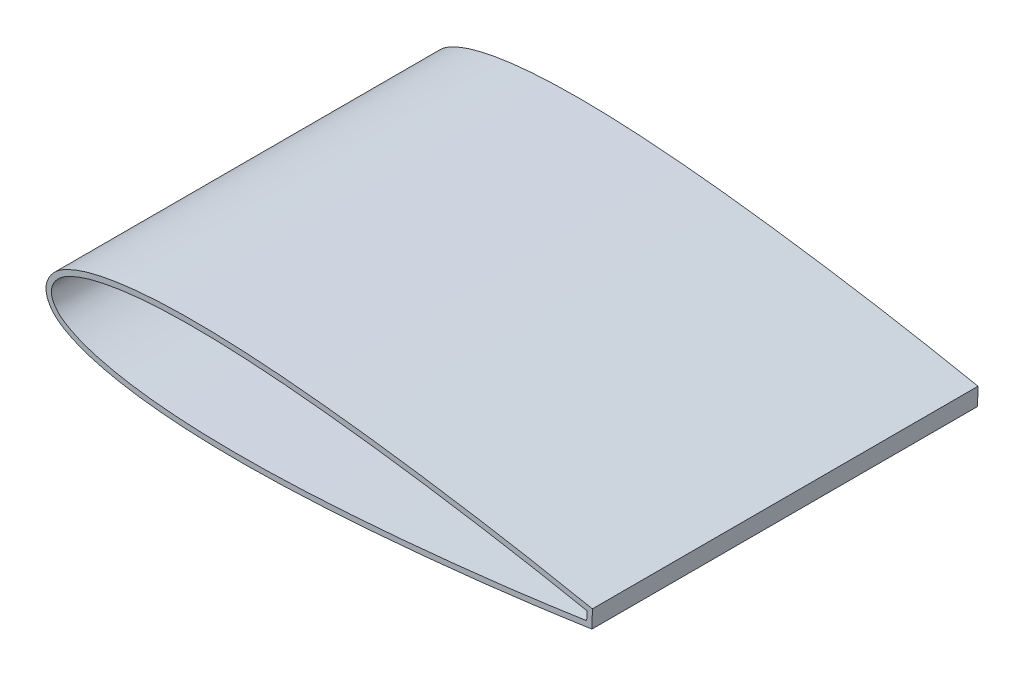
from build123d import *

# Parameters (mm, degrees)
SALIENTE_EXTRUIR1_DEPTH = 70
SALIENTE_EXTRUIR2_DEPTH = 2


with BuildPart() as part:
    # Croquis1 → Saliente-Extruir1 (new body)
    with BuildSketch(Plane.XY):
        with BuildLine():
            Line((100.937242611, -4.288444237), (101.020891316, -0.965925894))
            add(Edge.make_bspline(
                [(101.020891316, -0.965925894), (96.815291407, -0.132900663), (88.398945531, 1.498301529), (75.701280173, 3.619117953), (65.092277681, 5.174420406), (56.575812426, 6.26109804), (50.172982061, 6.981711997), (43.751572486, 7.593424271), (37.308792099, 8.061989495), (30.843527308, 8.352139743), (25.435555721, 8.401904422), (21.096425097, 8.283801601), (17.836833169, 8.098688927), (14.572616656, 7.799403619), (11.300179337, 7.349746902), (8.578434848, 6.808392395), (6.396383224, 6.231750099), (4.745451812, 5.682992115), (3.125080642, 4.988256194), (1.502764958, 4.120049599), (0.070003363, 2.835558423), (-0.776195719, 1.331451533), (-1.099161709, -0.057233354), (-0.846484471, -1.460410805), (-0.077045136, -3.005193487), (1.289264818, -4.360154916), (2.865836447, -5.308897645), (4.449195193, -6.08429162), (6.070421174, -6.715430408), (8.220691339, -7.40114452), (10.911746345, -8.078773269), (14.15741081, -8.692531647), (17.402431679, -9.155695443), (20.648579068, -9.504598536), (24.97626948, -9.840899809), (30.379893961, -10.063331075), (36.851568545, -10.098885043), (43.309765174, -9.955118637), (49.753821325, -9.667311138), (56.184801812, -9.269805003), (64.745160028, -8.613058533), (75.418985998, -7.593578871), (88.207285786, -6.114404653), (96.695052319, -4.908785399), (100.937242611, -4.288444237)],
                knots=[-0.007442072, -0.007442072, -0.007442072, -0.007442072, 0.055988187, 0.119418446, 0.182848705, 0.214563835, 0.246278964, 0.277994094, 0.309709223, 0.341424353, 0.373139482, 0.388997047, 0.404854612, 0.420712176, 0.436569741, 0.452427306, 0.460356088, 0.468284871, 0.476213653, 0.484142435, 0.492071218, 0.496035609, 0.5, 0.503964391, 0.507928782, 0.515857565, 0.523786347, 0.531715129, 0.539643912, 0.547572694, 0.563430259, 0.579287824, 0.595145388, 0.611002953, 0.626860518, 0.658575647, 0.690290777, 0.722005906, 0.753721036, 0.785436165, 0.817151295, 0.880581554, 0.944011813, 1.007442072, 1.007442072, 1.007442072, 1.007442072], degree=3))
        make_face()
        with BuildLine():
            Line((99.958767472, -3.420892718), (100, -1.783140771))
            add(Edge.make_bspline(
                [(100, -1.783140771), (95.834430226, -0.958044519), (87.493341503, 0.643007476), (74.92283071, 2.727733467), (62.313738875, 4.564075903), (49.656886325, 6.084765045), (39.060280254, 6.989417585), (30.550694733, 7.359111002), (24.154602236, 7.407912917), (18.817306664, 7.18883232), (14.552103281, 6.789952354), (11.358212052, 6.344535771), (8.185565208, 5.706610836), (5.563950621, 4.948823424), (3.511123189, 4.06369616), (2.041867828, 3.263736438), (0.599002867, 1.952554653), (-0.278987019, -0.077882315), (0.495717549, -2.149928008), (1.870774979, -3.532054641), (3.297914427, -4.404934857), (5.303600935, -5.392240469), (7.883761837, -6.280989321), (11.020288463, -7.077755876), (14.187719714, -7.683326997), (18.427447641, -8.296329633), (23.746957166, -8.78370911), (30.137402271, -9.056824852), (38.654810324, -9.115808067), (49.28351442, -8.745530221), (62.000854282, -7.86366926), (74.686377832, -6.664151551), (87.34586805, -5.214623536), (95.756955594, -4.035329291), (99.958767472, -3.420892718)],
                knots=[-0.003280902, -0.003280902, -0.003280902, -0.003280902, 0.059629211, 0.122539324, 0.185449436, 0.248359549, 0.311269662, 0.342724718, 0.374179775, 0.405634831, 0.421362359, 0.437089887, 0.452817415, 0.468544944, 0.476408708, 0.484272472, 0.492136236, 0.5, 0.507863764, 0.515727528, 0.523591292, 0.531455056, 0.547182585, 0.562910113, 0.578637641, 0.594365169, 0.625820225, 0.657275282, 0.688730338, 0.751640451, 0.814550564, 0.877460676, 0.940370789, 1.003280902, 1.003280902, 1.003280902, 1.003280902], degree=3))
        make_face(mode=Mode.SUBTRACT)
    extrude(amount=SALIENTE_EXTRUIR1_DEPTH)

    # Croquis4 → Saliente-Extruir2 (add)
    with BuildSketch(Plane(origin=(0, 0, 0), x_dir=(-1, 0, 0), z_dir=(0, 0, -1))):
        with BuildLine():
            Line((-100.937242611, -4.288444237), (-101.020891316, -0.965925894))
            add(Edge.make_bspline(
                [(-101.020891316, -0.965925894), (-96.815291407, -0.132900663), (-88.398945531, 1.498301529), (-75.701280173, 3.619117953), (-65.092277681, 5.174420406), (-56.575812426, 6.26109804), (-50.172982061, 6.981711997), (-43.751572486, 7.593424271), (-37.308792099, 8.061989495), (-30.843527308, 8.352139743), (-25.435555721, 8.401904422), (-21.096425097, 8.283801601), (-17.836833169, 8.098688927), (-14.572616656, 7.799403619), (-11.300179337, 7.349746902), (-8.578434848, 6.808392395), (-6.396383224, 6.231750099), (-4.745451812, 5.682992115), (-3.125080642, 4.988256194), (-1.502764958, 4.120049599), (-0.070003363, 2.835558423), (0.776195719, 1.331451533), (1.099161709, -0.057233354), (0.846484471, -1.460410805), (0.077045136, -3.005193487), (-1.289264818, -4.360154916), (-2.865836447, -5.308897645), (-4.449195193, -6.08429162), (-6.070421174, -6.715430408), (-8.220691339, -7.40114452), (-10.911746345, -8.078773269), (-14.15741081, -8.692531647), (-17.402431679, -9.155695443), (-20.648579068, -9.504598536), (-24.97626948, -9.840899809), (-30.379893961, -10.063331075), (-36.851568545, -10.098885043), (-43.309765174, -9.955118637), (-49.753821325, -9.667311138), (-56.184801812, -9.269805003), (-64.745160028, -8.613058533), (-75.418985998, -7.593578871), (-88.207285786, -6.114404653), (-96.695052319, -4.908785399), (-100.937242611, -4.288444237)],
                knots=[-0.007442072, -0.007442072, -0.007442072, -0.007442072, 0.055988187, 0.119418446, 0.182848705, 0.214563835, 0.246278964, 0.277994094, 0.309709223, 0.341424353, 0.373139482, 0.388997047, 0.404854612, 0.420712176, 0.436569741, 0.452427306, 0.460356088, 0.468284871, 0.476213653, 0.484142435, 0.492071218, 0.496035609, 0.5, 0.503964391, 0.507928782, 0.515857565, 0.523786347, 0.531715129, 0.539643912, 0.547572694, 0.563430259, 0.579287824, 0.595145388, 0.611002953, 0.626860518, 0.658575647, 0.690290777, 0.722005906, 0.753721036, 0.785436165, 0.817151295, 0.880581554, 0.944011813, 1.007442072, 1.007442072, 1.007442072, 1.007442072], degree=3))
        make_face()
    extrude(amount=SALIENTE_EXTRUIR2_DEPTH)


solid = part.part
